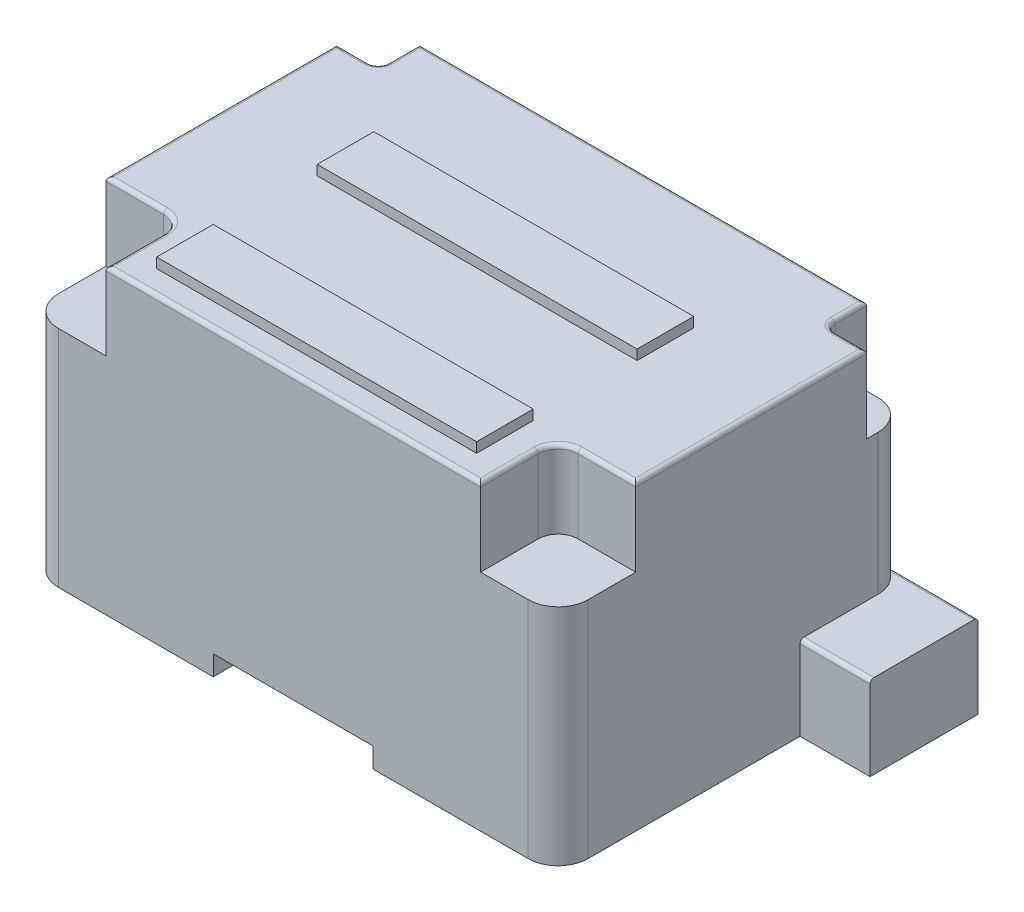
from build123d import *

# Parameters (mm, degrees)
SKETCH_1_W          = 26.5
SKETCH_1_H          = 17.5
EXTRUDE_1_DEPTH     = 15.1
SKETCH_2_W          = 5.4
SKETCH_2_H          = 4.2
EXTRUDE_2_DEPTH     = 3.5
SKETCH_3_W          = 2.08
SKETCH_3_H          = 2.08
SKETCH_3_W_2        = 3.88
SKETCH_3_H_2        = 3.88
CUT_EXTRUDE_1_DEPTH = 3.88
SKETCH_4_W          = 8
SKETCH_4_H          = 2
CUT_EXTRUDE_2_DEPTH = 1
FILLET_1_R          = 1.5
FILLET_2_R          = 1
FILLET_3_R          = 0.5
FILLET_4_R          = 0.2
SKETCH_5_W          = 16
SKETCH_5_H          = 2.83
EXTRUDE_3_DEPTH     = 0.5


with BuildPart() as part:
    # 草图1 → 凸台-拉伸1 (new body)
    with BuildSketch(Plane(origin=(0, 0, 0), x_dir=(1, 0, 0), z_dir=(0, 1, 0))):
        Rectangle(SKETCH_1_W, SKETCH_1_H)
    extrude(amount=EXTRUDE_1_DEPTH)

    # 草图2 → 凸台-拉伸2 (add)
    with BuildSketch(Plane(origin=(13.25, 0, 0), x_dir=(0, 0, -1), z_dir=(1, 0, 0))):
        with Locations((6.05, 2.1)):
            Rectangle(SKETCH_2_W, SKETCH_2_H)
    extrude(amount=EXTRUDE_2_DEPTH)

    # 草图3 → 切除-拉伸1 (cut)
    with BuildSketch(Plane(origin=(0, 15.1, 0), x_dir=(1, 0, 0), z_dir=(0, 1, 0))):
        with Locations((-12.21, 7.71)):
            Rectangle(SKETCH_3_W, SKETCH_3_H)
        with Locations((-11.31, -6.81)):
            Rectangle(SKETCH_3_W_2, SKETCH_3_H_2)
        with Locations((11.31, -6.81)):
            Rectangle(SKETCH_3_W_2, SKETCH_3_H_2)
        with Locations((12.21, 7.71)):
            Rectangle(SKETCH_3_W, SKETCH_3_H)
    extrude(amount=-CUT_EXTRUDE_1_DEPTH, mode=Mode.SUBTRACT)

    # 草图4 → 切除-拉伸2 (cut)
    with BuildSketch(Plane.XZ):
        with Locations((0, 8.75)):
            Rectangle(SKETCH_4_W, SKETCH_4_H)
    extrude(amount=-CUT_EXTRUDE_2_DEPTH, mode=Mode.SUBTRACT)

    # 圆角1
    fillet_1_edges = [part.edges().sort_by_distance(p)[0] for p in [
        (13.25, 5.61, 8.75),
        (-13.25, 5.61, 8.75),
        (-13.25, 5.61, -8.75),
        (13.25, 7.71, -8.75),
    ]]
    fillet(fillet_1_edges, radius=FILLET_1_R)

    # 圆角2
    fillet_2_edges = [part.edges().sort_by_distance(p)[0] for p in [
        (9.37, 13.16, 4.87),
        (-9.37, 13.16, 4.87),
    ]]
    fillet(fillet_2_edges, radius=FILLET_2_R)

    # 圆角3
    fillet_3_edges = [part.edges().sort_by_distance(p)[0] for p in [
        (11.17, 13.16, -6.67),
        (-11.17, 13.16, -6.67),
    ]]
    fillet(fillet_3_edges, radius=FILLET_3_R)

    # 圆角4
    fillet_4_edges = [part.edges().sort_by_distance(p)[0] for p in [
        (9.37, 15.1, 7.31),
        (-11.81, 15.1, 4.87),
        (9.662893219, 15.1, 5.162893219),
        (-9.662893219, 15.1, 5.162893219),
        (-11.17, 15.1, -7.96),
        (12.46, 15.1, -6.67),
        (-11.316446609, 15.1, -6.816446609),
        (11.316446609, 15.1, -6.816446609),
        (14.25, 4.2, -8.75),
        (15, 4.2, -3.35),
        (13.25, 15.1, -0.9),
        (0, 15.1, -8.75),
        (-13.25, 15.1, -0.9),
        (0, 15.1, 8.75),
        (11.17, 15.1, -7.96),
        (11.81, 15.1, 4.87),
        (-9.37, 15.1, 7.31),
        (-12.46, 15.1, -6.67),
    ]]
    fillet(fillet_4_edges, radius=FILLET_4_R)

    # 草图5 → 凸台-拉伸3 (add)
    with BuildSketch(Plane(origin=(0, 15.1, 0), x_dir=(1, 0, 0), z_dir=(0, 1, 0))):
        with Locations((0, 1.865)):
            Rectangle(SKETCH_5_W, SKETCH_5_H)
        with Locations((0, -6.165)):
            Rectangle(SKETCH_5_W, SKETCH_5_H)
    extrude(amount=EXTRUDE_3_DEPTH)


solid = part.part
